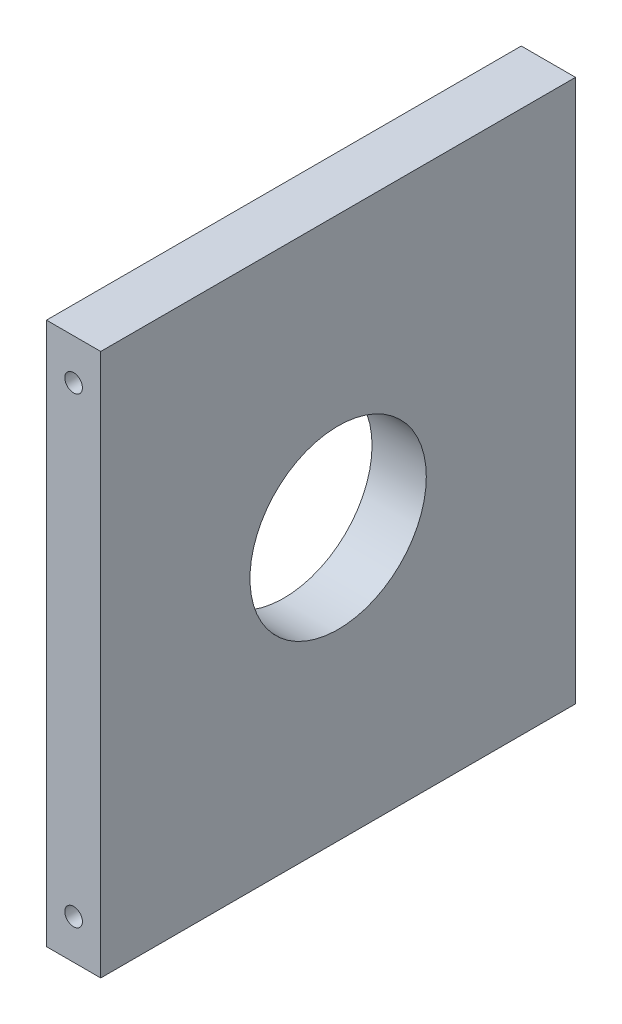
from build123d import *

# Parameters (mm, degrees)
SKETCH_1_W          = 70
SKETCH_1_H          = 80
EXTRUDE_1_DEPTH     = 8
SKETCH_4_R          = 13
CUT_EXTRUDE_2_DEPTH = 8
SKETCH_5_R          = 1.3
CUT_EXTRUDE_3_DEPTH = 10


with BuildPart() as part:
    # 草图1 → 凸台-拉伸1 (new body)
    with BuildSketch(Plane(origin=(0, 0, 0), x_dir=(0, 0, -1), z_dir=(1, 0, 0))):
        Rectangle(SKETCH_1_W, SKETCH_1_H)
    extrude(amount=EXTRUDE_1_DEPTH)

    # 草图4 → 切除-拉伸2 (cut)
    with BuildSketch(Plane(origin=(8, 0, 0), x_dir=(0, 0, -1), z_dir=(1, 0, 0))):
        Circle(SKETCH_4_R)
    extrude(amount=-CUT_EXTRUDE_2_DEPTH, mode=Mode.SUBTRACT)

    # 草图5 → 切除-拉伸3 (cut)
    with BuildSketch(Plane.XY.offset(35)):
        with Locations((4, 34)):
            Circle(SKETCH_5_R)
        with Locations((4, -34.156756408)):
            Circle(SKETCH_5_R)
    cut_extrude_3 = extrude(amount=-CUT_EXTRUDE_3_DEPTH, mode=Mode.SUBTRACT)

    # 镜向1: 切除-拉伸3 across plane
    add(cut_extrude_3.mirror(Plane.XY), mode=Mode.SUBTRACT)


solid = part.part
